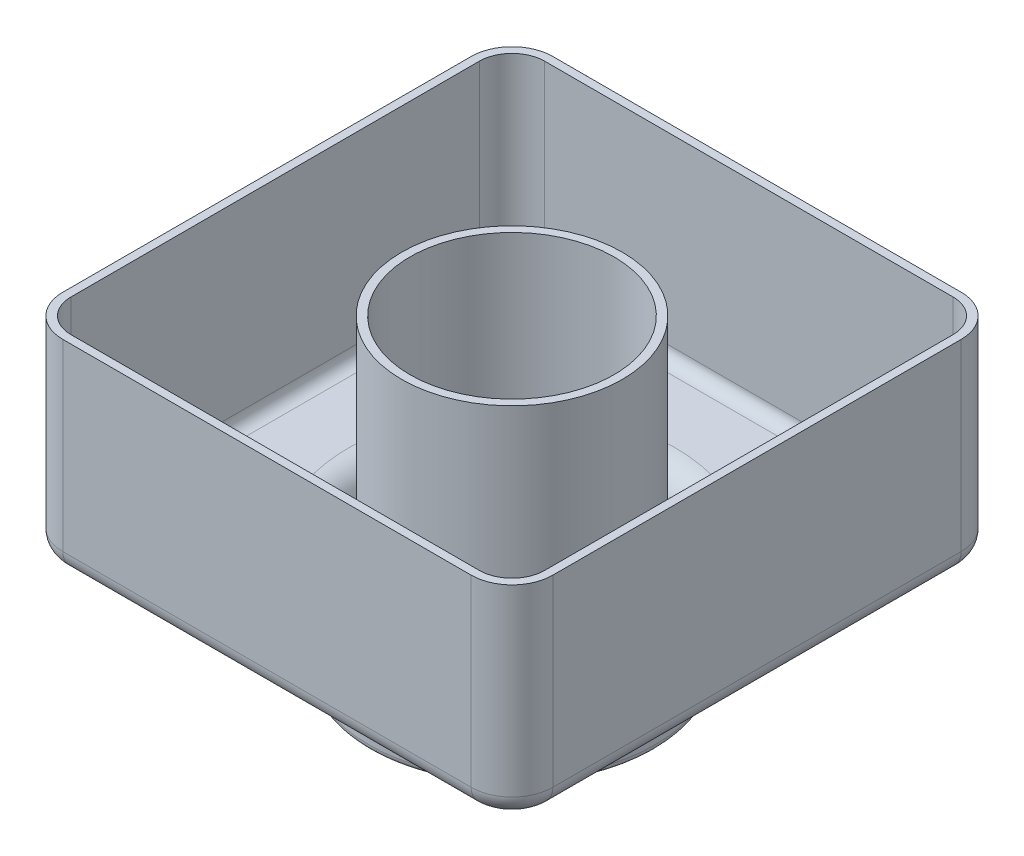
from build123d import *

# Parameters (mm, degrees)
SKETCH_1_W          = 120
SKETCH_1_H          = 120
EXTRUDE_1_DEPTH     = 50
SKETCH_3_R          = 35
EXTRUDE_2_DEPTH     = 25
SKETCH_4_R          = 25
CUT_EXTRUDE_1_DEPTH = 186.539753153
FILLET_1_R          = 10
FILLET_2_R          = 1.5
FILLET_3_R          = 5
SHELL_1_T           = -2


with BuildPart() as part:
    # 草图1 → 凸台-拉伸1 (new body)
    with BuildSketch(Plane(origin=(0, 0, 0), x_dir=(1, 0, 0), z_dir=(0, 1, 0))):
        with Locations((60, 60)):
            Rectangle(SKETCH_1_W, SKETCH_1_H)
    extrude(amount=EXTRUDE_1_DEPTH)

    # 草图3 → 凸台-拉伸2 (add)
    with BuildSketch(Plane.XZ):
        with Locations(Location((60, -60, 0), (0, 0, 270))):
            Circle(SKETCH_3_R)
    extrude(amount=EXTRUDE_2_DEPTH)

    # 草图4 → 切除-拉伸1 (cut, through all)
    with BuildSketch(Plane.XZ.offset(25)):
        with Locations(Location((60, -60, 0), (0, 0, 270))):
            Circle(SKETCH_4_R)
    extrude(amount=-CUT_EXTRUDE_1_DEPTH, mode=Mode.SUBTRACT)

    # 圆角1
    fillet_1_edges = [part.edges().sort_by_distance(p)[0] for p in [
        (0, 25, -120),
        (120, 25, -120),
        (120, 25, 0),
        (0, 25, 0),
    ]]
    fillet(fillet_1_edges, radius=FILLET_1_R)

    # 圆角2
    fillet_2_edges = [part.edges().sort_by_distance(p)[0] for p in [
        (60, -25, -25),
        (60, -25, -35),
    ]]
    fillet(fillet_2_edges, radius=FILLET_2_R)

    # 圆角3
    fillet_3_edges = [part.edges().sort_by_distance(p)[0] for p in [
        (60, 0, -25),
        (60, 0, -120),
        (0, 0, -60),
        (120, 0, -60),
        (60, 0, 0),
        (117.071067812, 0, -2.928932188),
        (2.928932188, 0, -2.928932188),
        (2.928932188, 0, -117.071067812),
        (117.071067812, 0, -117.071067812),
    ]]
    fillet(fillet_3_edges, radius=FILLET_3_R)

    # 抽壳1
    shell_1_openings = [part.faces().sort_by_distance(p)[0] for p in [
        (60, 50, -1.697056275),
    ]]
    offset(amount=SHELL_1_T, openings=shell_1_openings, kind=Kind.INTERSECTION)


solid = part.part
